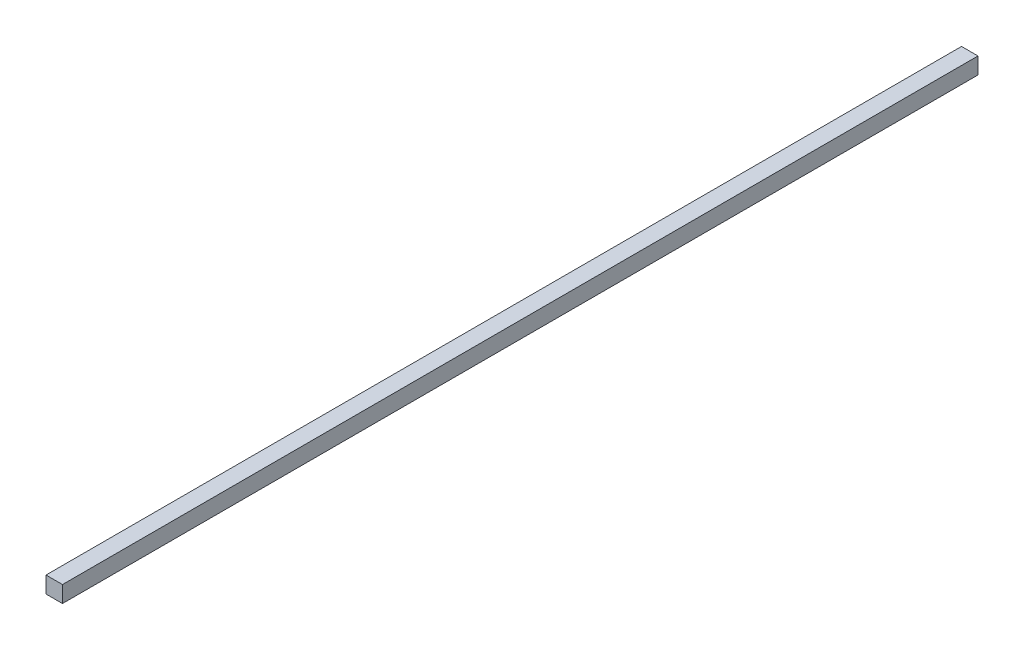
from build123d import *

# Parameters (mm, degrees)
SKETCH1_W           = 18
SKETCH1_H           = 18
BOSS_EXTRUDE1_DEPTH = 1000


with BuildPart() as part:
    # Sketch1 → Boss-Extrude1 (new body)
    with BuildSketch(Plane.XY):
        Rectangle(SKETCH1_W, SKETCH1_H)
    extrude(amount=BOSS_EXTRUDE1_DEPTH)


solid = part.part
